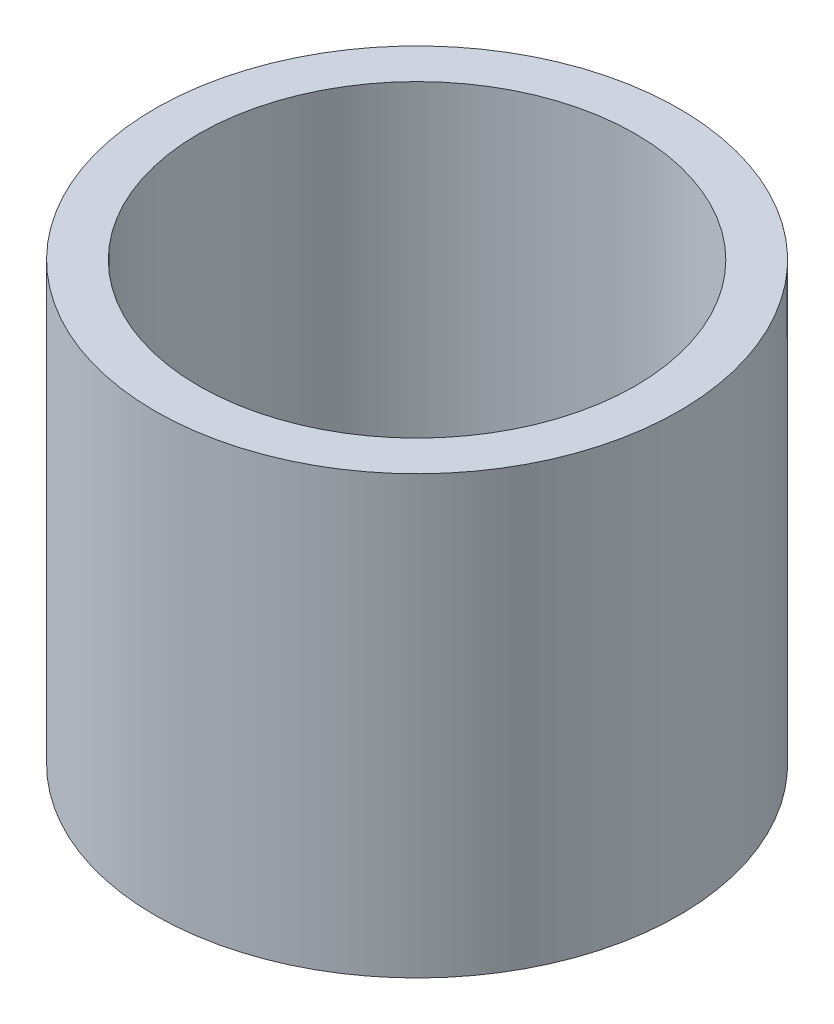
from build123d import *

# Parameters (mm, degrees)
SKETCH1_W = 0.5
SKETCH1_H = 5


with BuildPart() as part:
    # Sketch1 → Revolve1 (revolve)
    with BuildSketch(Plane.XY, mode=Mode.PRIVATE) as revolve1_sk:
        with Locations((-2.75, 2.5)):
            Rectangle(SKETCH1_W, SKETCH1_H)
    revolve(revolve1_sk.sketch.rotate(Axis((0, 12.451333261, 0), (0, -1, 0)), 270), axis=Axis((0, 12.451333261, 0), (0, -1, 0)))


solid = part.part
